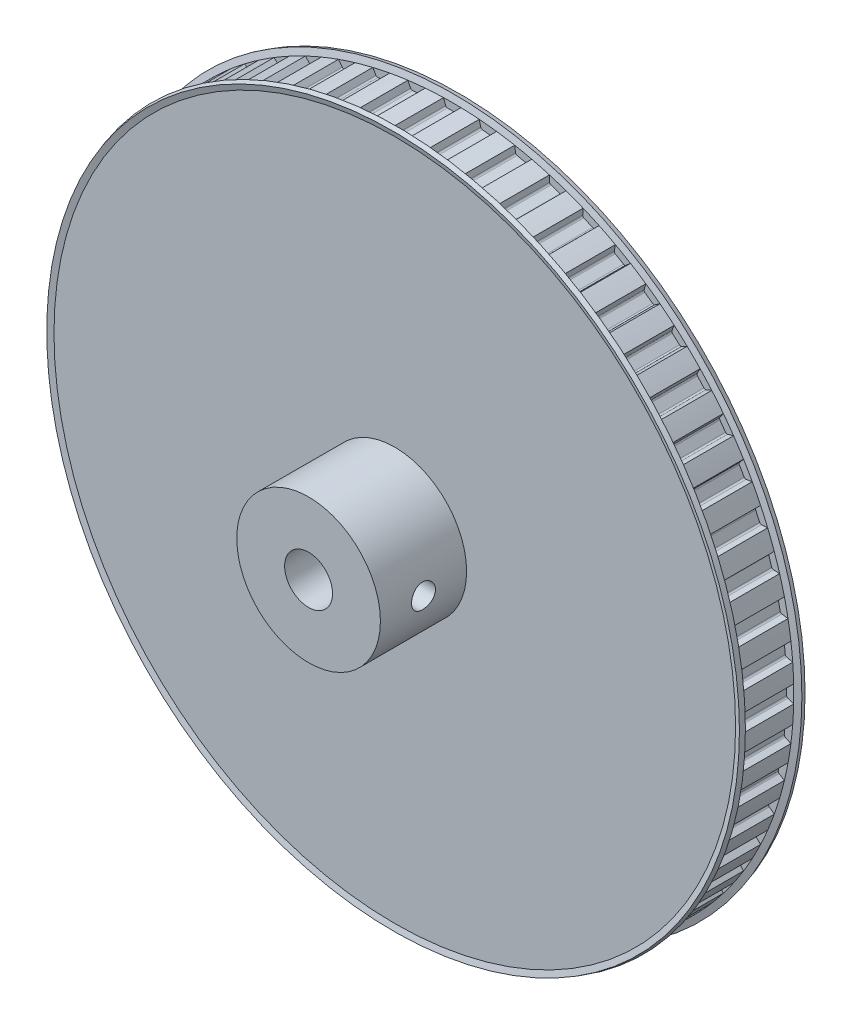
from build123d import *

# Parameters (mm, degrees)
SKETCH1_R               = 90.5764
BASEPULLEY_DEPTH        = 13.97
GROOVE_DEPTH            = 6.985
GROOVES_COUNT           = 60
GROOVES_ANGLE           = 354
SKETCH4_W               = 24.13
SKETCH4_H               = 19.05
BORSKE_R                = 6.35
BORE_DEPTH              = 137.372140692
CUT_EXTRUDE1_DEPTH      = 133.642540392
CUT_EXTRUDE1_DEPTH_BACK = 133.642540392
SKETCH5_R               = 3.175


with BuildPart() as part:
    # Sketch1 → BasePulley (new body)
    with BuildSketch(Plane.XY):
        Circle(SKETCH1_R)
    extrude(amount=-BASEPULLEY_DEPTH)

    # Sketch2 → Flange (revolve)
    with BuildSketch(Plane(origin=(0, 0, 0), x_dir=(0, 0, -1), z_dir=(1, 0, 0)), mode=Mode.PRIVATE) as flange_sk:
        Polygon((13.97, 90.5764), (14.474761355, 92.2274), (15.689268395, 91.856087935), (15.24, 90.386597228), (15.24, 0), (-1.27, 0), (-1.27, 90.386597228), (-1.719268395, 91.856087935), (-0.504761355, 92.2274), (0, 90.5764), align=None)
    revolve(flange_sk.sketch.rotate(Axis((0, 0, 0), (0, 0, -1)), 90), axis=Axis((0, 0, 0), (0, 0, -1)))

    # Sketch3 → Groove (cut, symmetric)
    with BuildSketch(Plane.XY.offset(-6.985)):
        with BuildLine():
            Line((-2.3241, 90.5764), (-2.3241, 115.9764))
            Line((-2.3241, 115.9764), (2.3241, 115.9764))
            Line((2.3241, 115.9764), (2.3241, 90.5764))
            Line((2.3241, 90.5764), (1.752395126, 89.005653767))
            ThreePointArc((1.752395126, 89.005653767), (1.566408104, 88.763270762), (1.275031274, 88.6714))
            Line((1.275031274, 88.6714), (-1.275031274, 88.6714))
            ThreePointArc((-1.275031274, 88.6714), (-1.566408104, 88.763270762), (-1.752395126, 89.005653767))
            Line((-1.752395126, 89.005653767), (-2.3241, 90.5764))
        make_face()
    groove = extrude(amount=GROOVE_DEPTH, both=True, mode=Mode.SUBTRACT)

    # Grooves: Groove ×60 about axis
    grooves_axis = Axis((0, 0, -13.97), (0, 0, 1))
    for i in range(1, GROOVES_COUNT):
        add(groove.rotate(grooves_axis, i * GROOVES_ANGLE / (GROOVES_COUNT - 1)), mode=Mode.SUBTRACT)

    # Sketch4 → BaseHub (revolve)
    with BuildSketch(Plane(origin=(0, 0, 0), x_dir=(0, 0, -1), z_dir=(1, 0, 0)), mode=Mode.PRIVATE) as basehub_sk:
        with Locations((-12.065, 9.525)):
            Rectangle(SKETCH4_W, SKETCH4_H)
    revolve(basehub_sk.sketch.rotate(Axis((0, 0, 0), (0, 0, -1)), 271.463508956), axis=Axis((0, 0, 0), (0, 0, -1)))

    # BorSke → Bore (cut, through all)
    with BuildSketch(Plane.XY.offset(24.13)):
        Circle(BORSKE_R)
    extrude(amount=-BORE_DEPTH, mode=Mode.SUBTRACT)

    # Sketch5 → Cut-Extrude1 (cut, two sides: drawn at the far end of the back side and taken through both)
    with BuildSketch(Plane(origin=(0, 0, 0), x_dir=(0, 0, -1), z_dir=(1, 0, 0)).offset(-CUT_EXTRUDE1_DEPTH_BACK)):
        with Locations((-12.7, 0)):
            Circle(SKETCH5_R)
    extrude(amount=CUT_EXTRUDE1_DEPTH + CUT_EXTRUDE1_DEPTH_BACK, mode=Mode.SUBTRACT)


solid = part.part
